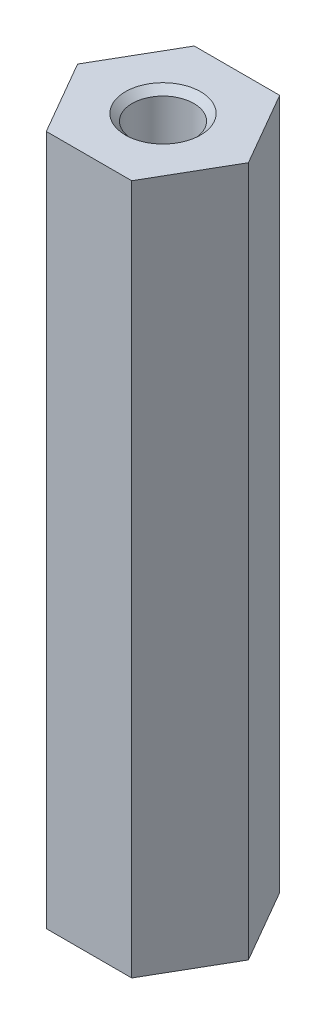
from build123d import *

# Parameters (mm, degrees)
AUFSATZ_LINEAR_AUSTRAGEN1_DEPTH = 28
M3_GEWINDEBOHRUNG1_D            = 2.5
M3_GEWINDEBOHRUNG1_CSINK_D      = 3.05
M3_GEWINDEBOHRUNG1_CSINK_ANGLE  = 90


with BuildPart() as part:
    # Skizze1 → Aufsatz-Linear austragen1 (new body)
    with BuildSketch(Plane(origin=(0, 0, 0), x_dir=(1, 0, 0), z_dir=(0, 1, 0))):
        Polygon((3.464101615, 0), (1.732050808, 3), (-1.732050808, 3), (-3.464101615, 0), (-1.732050808, -3), (1.732050808, -3), align=None)
    extrude(amount=AUFSATZ_LINEAR_AUSTRAGEN1_DEPTH)

    # M3 Gewindebohrung1 (through all)
    with Locations(Plane(origin=(0, 28, 0), x_dir=(1, 0, 0), z_dir=(0, 1, 0))):
        with Locations((0, 0)):
            CounterSinkHole(M3_GEWINDEBOHRUNG1_D / 2, M3_GEWINDEBOHRUNG1_CSINK_D / 2, counter_sink_angle=M3_GEWINDEBOHRUNG1_CSINK_ANGLE)


solid = part.part
